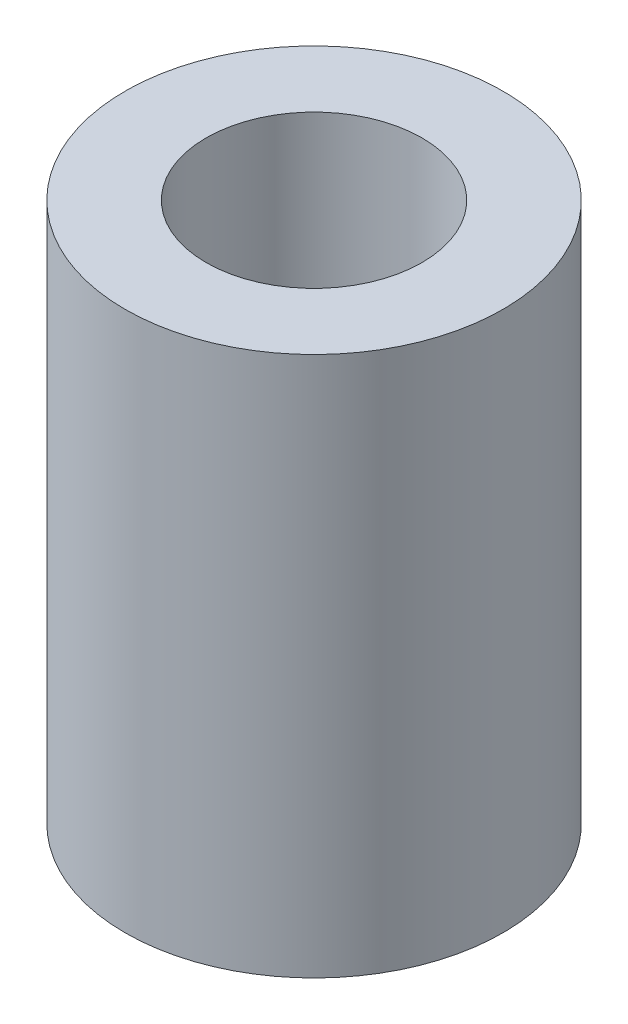
from build123d import *

# Parameters (mm, degrees)
SKETCH_1_R      = 3.5
SKETCH_1_R_2    = 2
EXTRUDE_1_DEPTH = 10


with BuildPart() as part:
    # Эскиз1 → Бобышка-Вытянуть1 (new body)
    with BuildSketch(Plane(origin=(0, 0, 0), x_dir=(1, 0, 0), z_dir=(0, 1, 0))):
        with Locations(Location((0, 0, 0), (0, 0, 270))):
            Circle(SKETCH_1_R)
        with Locations(Location((0, 0, 0), (0, 0, 270))):
            Circle(SKETCH_1_R_2, mode=Mode.SUBTRACT)
    extrude(amount=EXTRUDE_1_DEPTH)


solid = part.part
